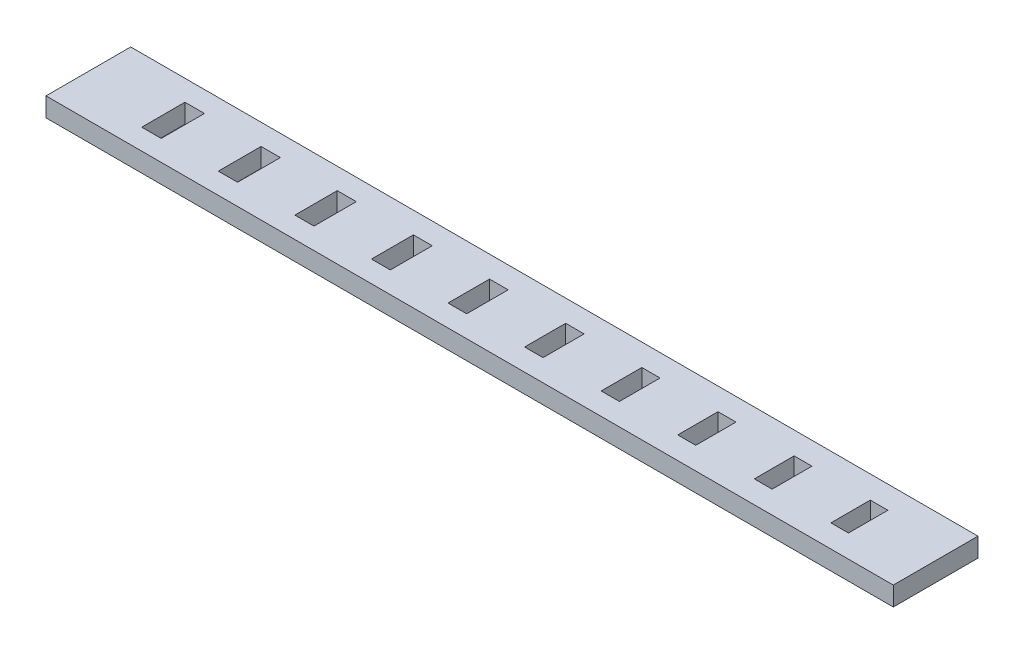
from build123d import *

# Parameters (mm, degrees)
SKETCH1_W           = 200
SKETCH1_H           = 20
SKETCH1_W_2         = 4.6
SKETCH1_H_2         = 10.2
SKETCH1_W_3         = 4.55
SKETCH1_H_3         = 10.1
SKETCH1_W_4         = 4.5
SKETCH1_H_4         = 10
SKETCH1_W_5         = 4.45
SKETCH1_H_5         = 9.9
SKETCH1_W_6         = 4.4
SKETCH1_H_6         = 9.8
SKETCH1_W_7         = 4.35
SKETCH1_H_7         = 9.7
SKETCH1_W_8         = 4.3
SKETCH1_H_8         = 9.6
SKETCH1_W_9         = 4.25
SKETCH1_H_9         = 9.5
SKETCH1_W_10        = 4.2
SKETCH1_H_10        = 9.4
SKETCH1_W_11        = 4.15
SKETCH1_H_11        = 9.3
BOSS_EXTRUDE1_DEPTH = 4.5


with BuildPart() as part:
    # Sketch1 → Boss-Extrude1 (new body)
    with BuildSketch(Plane(origin=(0, 0, 0), x_dir=(1, 0, 0), z_dir=(0, 1, 0))):
        Rectangle(SKETCH1_W, SKETCH1_H)
        with Locations((-80, 0)):
            Rectangle(SKETCH1_W_2, SKETCH1_H_2, mode=Mode.SUBTRACT)
        with Locations((-62, 0)):
            Rectangle(SKETCH1_W_3, SKETCH1_H_3, mode=Mode.SUBTRACT)
        with Locations((-44, 0)):
            Rectangle(SKETCH1_W_4, SKETCH1_H_4, mode=Mode.SUBTRACT)
        with Locations((-26, 0)):
            Rectangle(SKETCH1_W_5, SKETCH1_H_5, mode=Mode.SUBTRACT)
        with Locations((-8, 0)):
            Rectangle(SKETCH1_W_6, SKETCH1_H_6, mode=Mode.SUBTRACT)
        with Locations((10, 0)):
            Rectangle(SKETCH1_W_7, SKETCH1_H_7, mode=Mode.SUBTRACT)
        with Locations((28, 0)):
            Rectangle(SKETCH1_W_8, SKETCH1_H_8, mode=Mode.SUBTRACT)
        with Locations((46, 0)):
            Rectangle(SKETCH1_W_9, SKETCH1_H_9, mode=Mode.SUBTRACT)
        with Locations((64, 0)):
            Rectangle(SKETCH1_W_10, SKETCH1_H_10, mode=Mode.SUBTRACT)
        with Locations((82, 0)):
            Rectangle(SKETCH1_W_11, SKETCH1_H_11, mode=Mode.SUBTRACT)
    extrude(amount=BOSS_EXTRUDE1_DEPTH)


solid = part.part
